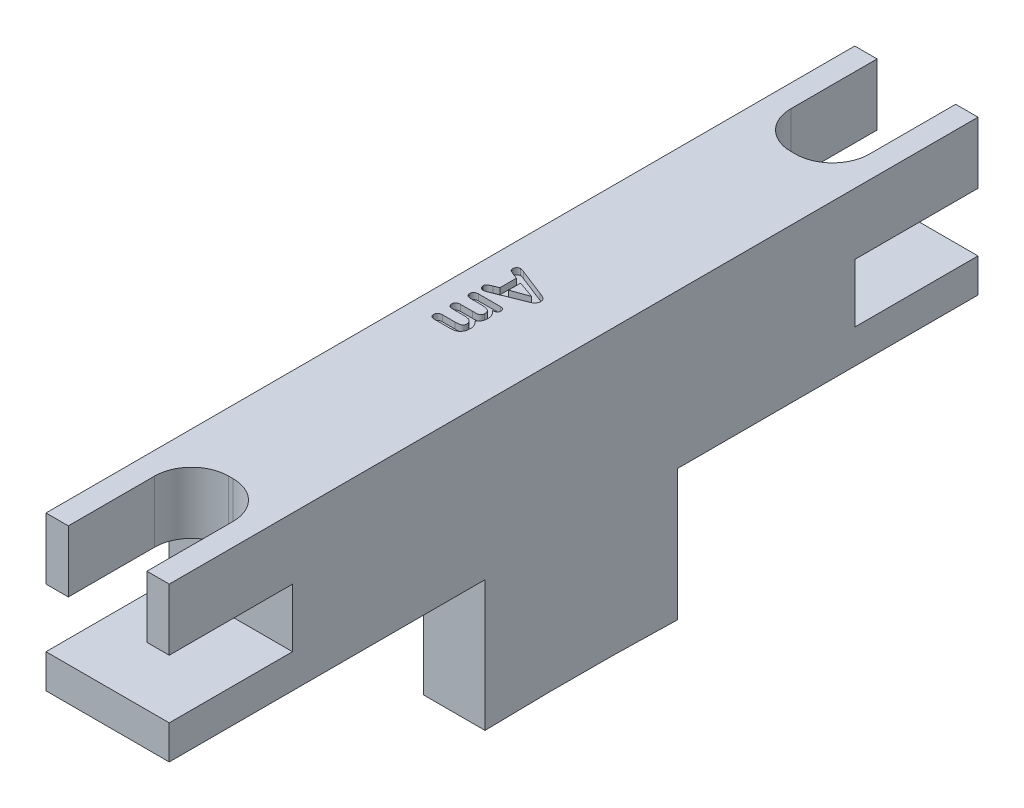
from build123d import *

# Parameters (mm, degrees)
SKETCH2_W            = 10.16
SKETCH2_H            = 66.675
BOSS_EXTRUDE1_DEPTH  = 12.7
SKETCH3_W            = 5.08
SKETCH3_H            = 6.35
SKETCH3_H_2          = 1.905
SKETCH3_H_3          = 1.27
BOSS_EXTRUDE2_DEPTH  = 12.7
CUT_EXTRUDE1_DEPTH   = 10.16
FILLET2_R            = 3.048
FILLET2_OF_MIRROR1_R = 3.048
CUT_EXTRUDE4_DEPTH   = 69.0635881
CUT_EXTRUDE5_DEPTH   = 0.508


with BuildPart() as part:
    # Sketch2 → Boss-Extrude1 (new body)
    with BuildSketch(Plane(origin=(0, 0, 0), x_dir=(1, 0, 0), z_dir=(0, 1, 0))):
        with Locations((5.08, 33.3375)):
            Rectangle(SKETCH2_W, SKETCH2_H)
    extrude(amount=BOSS_EXTRUDE1_DEPTH)

    # Sketch3 → Boss-Extrude2 (add)
    with BuildSketch(Plane.XZ):
        with Locations((7.62, -37.465)):
            Rectangle(SKETCH3_W, SKETCH3_H)
        with Locations((7.62, -33.3375)):
            Rectangle(SKETCH3_W, SKETCH3_H_2)
        with Locations((7.62, -29.21)):
            Rectangle(SKETCH3_W, SKETCH3_H)
        with Locations((7.62, -41.275)):
            Rectangle(SKETCH3_W, SKETCH3_H_3)
    extrude(amount=BOSS_EXTRUDE2_DEPTH)

    # Sketch4 → Cut-Extrude1 (cut)
    with BuildSketch(Plane.XY):
        Polygon((0, 7.62), (1.8415, 7.62), (1.8415, 12.7), (8.3185, 12.7), (8.3185, 7.62), (10.16, 7.62), (10.16, 2.794), (0, 2.794), align=None)
    cut_extrude1 = extrude(amount=-CUT_EXTRUDE1_DEPTH, mode=Mode.SUBTRACT)

    # Fillet2
    fillet2_edges = [part.edges().sort_by_distance(p)[0] for p in [
        (1.8415, 10.16, -10.16),
        (8.3185, 10.16, -10.16),
    ]]
    fillet(fillet2_edges, radius=FILLET2_R)

    # Mirror1: Cut-Extrude1 across plane
    add(cut_extrude1.mirror(Plane.XY.offset(-33.3375)), mode=Mode.SUBTRACT)

    # Fillet2 of Mirror1
    fillet2_of_mirror1_edges = [part.edges().sort_by_distance(p)[0] for p in [
        (1.8415, 10.16, -56.515),
        (8.3185, 10.16, -56.515),
    ]]
    fillet(fillet2_of_mirror1_edges, radius=FILLET2_OF_MIRROR1_R)

    # Sketch5 → Cut-Extrude4 (cut, through all)
    with BuildSketch(Plane.ZY.offset(-5.08)):
        with BuildLine():
            Line((-66.675, -12.7), (0, -12.7))
            ThreePointArc((0, -12.7), (-33.3375, -10.668), (-66.675, -12.7))
        make_face()
    extrude(amount=-CUT_EXTRUDE4_DEPTH, mode=Mode.SUBTRACT)

    # Sketch6 → Cut-Extrude5 (cut)
    # profile 1 of 2: a face of its own
    with BuildSketch(Plane(origin=(0, 12.7, 0), x_dir=(1, 0, 0), z_dir=(0, 1, 0))):
        with BuildLine():
            Line((3.024117187, 31.325), (2.192183594, 31.325))
            add(Edge.make_bspline(
                [(2.192183594, 31.325), (2.161338143, 31.325878008), (2.102981292, 31.327539122), (2.021373075, 31.344309551), (1.951866233, 31.373035235), (1.89508713, 31.413356319), (1.851267035, 31.46353237), (1.820049132, 31.521488509), (1.800862639, 31.586765491), (1.798813173, 31.632709318), (1.79775, 31.656542969)],
                knots=[0, 0, 0, 0, 1.266358617, 2.395837985, 3.40284976, 4.335732349, 5.231599188, 6.115692377, 7.022503512, 8, 8, 8, 8], degree=3))
            add(Edge.make_bspline(
                [(1.79775, 31.656542969), (1.798843764, 31.679686433), (1.800961405, 31.724494561), (1.81986295, 31.788120989), (1.851709039, 31.844363979), (1.895295371, 31.893564924), (1.951696335, 31.934063962), (2.02156354, 31.961716326), (2.10295026, 31.978783323), (2.161327413, 31.980397043), (2.192183594, 31.98125)],
                knots=[0, 0, 0, 0, 0.959247536, 1.857201947, 2.725516035, 3.623470446, 4.565917911, 5.579597411, 6.720657367, 8, 8, 8, 8], degree=3))
            Line((2.192183594, 31.98125), (3.189546875, 31.98125))
            add(Edge.make_bspline(
                [(3.189546875, 31.98125), (3.226692841, 31.981223581), (3.296674033, 31.981173808), (3.394897567, 31.984906505), (3.479936742, 31.989459486), (3.553156116, 31.995540119), (3.617305611, 32.006964235), (3.674493623, 32.025290013), (3.725720355, 32.050814077), (3.771240201, 32.083049666), (3.809351895, 32.124445714), (3.835651207, 32.17742662), (3.851232332, 32.240133271), (3.853039715, 32.285350526), (3.854, 32.309375)],
                knots=[0, 0, 0, 0, 1.575327959, 2.967841215, 4.168135644, 5.187490071, 6.082165716, 6.925686306, 7.72526632, 8.500469833, 9.28059761, 10.084546151, 10.982296201, 12, 12, 12, 12], degree=3))
            add(Edge.make_bspline(
                [(3.854, 32.309375), (3.853337257, 32.334015012), (3.852067681, 32.381216385), (3.842681588, 32.448719982), (3.826351273, 32.509691135), (3.803025404, 32.564352632), (3.773055951, 32.612570717), (3.735927836, 32.653850858), (3.692336163, 32.688254591), (3.642242947, 32.716313631), (3.58623843, 32.739290145), (3.524705548, 32.759003945), (3.457448176, 32.77513591), (3.384667297, 32.788774807), (3.306216997, 32.79976157), (3.221778995, 32.806891792), (3.131731589, 32.811976909), (3.06969796, 32.812322325), (3.037789062, 32.8125)],
                knots=[0, 0, 0, 0, 1.072726865, 2.054957592, 2.959985853, 3.813338004, 4.633692391, 5.420603725, 6.218633423, 7.040726042, 7.912341107, 8.850536995, 9.851629862, 10.921921998, 12.073946012, 13.299226168, 14.610774249, 16, 16, 16, 16], degree=3))
            Line((3.037789062, 32.8125), (2.192183594, 32.8125))
            add(Edge.make_bspline(
                [(2.192183594, 32.8125), (2.161552126, 32.813328724), (2.103843245, 32.814890019), (2.02316301, 32.832184428), (1.953847019, 32.859952119), (1.896609997, 32.899459611), (1.85188122, 32.948701923), (1.820958279, 33.006375095), (1.800694973, 33.070474309), (1.798751978, 33.115855379), (1.79775, 33.139257813)],
                knots=[0, 0, 0, 0, 1.266988192, 2.386972462, 3.398328206, 4.340886206, 5.243074081, 6.125898592, 7.033549998, 8, 8, 8, 8], degree=3))
            add(Edge.make_bspline(
                [(1.79775, 33.139257813), (1.798869895, 33.162393548), (1.80104872, 33.207405546), (1.819874651, 33.271833894), (1.852279366, 33.32877973), (1.895950618, 33.379235864), (1.952923361, 33.419991156), (2.022429987, 33.448325157), (2.103070777, 33.46656772), (2.160854711, 33.467993727), (2.1915, 33.46875)],
                knots=[0, 0, 0, 0, 0.955872848, 1.859709514, 2.746023205, 3.64789137, 4.600178314, 5.613935963, 6.734568273, 8, 8, 8, 8], degree=3))
            Line((2.1915, 33.46875), (3.980464844, 33.46875))
            add(Edge.make_bspline(
                [(3.980464844, 33.46875), (4.008101113, 33.467683688), (4.060409743, 33.465665422), (4.133992186, 33.451195351), (4.197150319, 33.425017781), (4.249201116, 33.388319021), (4.290405501, 33.34328902), (4.319733645, 33.290656438), (4.337397212, 33.231061927), (4.339134632, 33.189056842), (4.340035156, 33.167285156)],
                knots=[0, 0, 0, 0, 1.248966492, 2.363985007, 3.370183095, 4.316060979, 5.220194925, 6.105537004, 7.018079506, 8, 8, 8, 8], degree=3))
            add(Edge.make_bspline(
                [(4.340035156, 33.167285156), (4.339007203, 33.146221694), (4.337020526, 33.105513343), (4.320883377, 33.046874237), (4.292862515, 32.994350507), (4.255213555, 32.947781037), (4.208366036, 32.908504088), (4.151723336, 32.881317106), (4.087389416, 32.864402381), (4.041873684, 32.862640476), (4.0180625, 32.86171875)],
                knots=[0, 0, 0, 0, 1.012533589, 1.956875484, 2.898540199, 3.857472998, 4.823338609, 5.81384557, 6.856331155, 8, 8, 8, 8], degree=3))
            Line((4.0180625, 32.86171875), (3.958589844, 32.86171875))
            add(Edge.make_bspline(
                [(3.958589844, 32.86171875), (3.989495812, 32.83453811), (4.049384416, 32.781868327), (4.127097834, 32.694631303), (4.192658891, 32.60514066), (4.245248165, 32.511662835), (4.286098435, 32.414457494), (4.314838778, 32.312319166), (4.332421459, 32.204941824), (4.334295126, 32.131480813), (4.33525, 32.094042969)],
                knots=[0, 0, 0, 0, 1.114634638, 2.159903633, 3.159301083, 4.116094819, 5.060065846, 6.010198919, 6.985940124, 8, 8, 8, 8], degree=3))
            add(Edge.make_bspline(
                [(4.33525, 32.094042969), (4.334015287, 32.055701909), (4.331621087, 31.98135579), (4.314678178, 31.873746537), (4.285147187, 31.774479877), (4.244165042, 31.683337302), (4.190410827, 31.60061054), (4.125083819, 31.5258336), (4.047472005, 31.458456315), (3.988748079, 31.421318549), (3.958589844, 31.402246094)],
                knots=[0, 0, 0, 0, 1.110106727, 2.152578117, 3.144193379, 4.100926543, 5.036166651, 5.990211141, 6.967853688, 8, 8, 8, 8], degree=3))
            add(Edge.make_bspline(
                [(3.958589844, 31.402246094), (3.98885654, 31.37535606), (4.047694923, 31.3230819), (4.126823395, 31.239126771), (4.190768194, 31.150086851), (4.244734685, 31.059341017), (4.285394996, 30.963877585), (4.313953875, 30.863748841), (4.33261384, 30.758768079), (4.33436203, 30.686831969), (4.33525, 30.650292969)],
                knots=[0, 0, 0, 0, 1.115367949, 2.168272612, 3.170386143, 4.129817974, 5.072087581, 6.019862948, 6.994215459, 8, 8, 8, 8], degree=3))
            add(Edge.make_bspline(
                [(4.33525, 30.650292969), (4.334213999, 30.608284885), (4.332203535, 30.526764016), (4.312525513, 30.409054529), (4.281307986, 30.300094622), (4.237713481, 30.200532614), (4.182074936, 30.111495752), (4.115195482, 30.034052363), (4.037027956, 29.968311192), (3.977660387, 29.935455139), (3.947652344, 29.918847656)],
                knots=[0, 0, 0, 0, 1.152941859, 2.237398496, 3.267298389, 4.259246934, 5.212555278, 6.139849645, 7.059764894, 8, 8, 8, 8], degree=3))
            add(Edge.make_bspline(
                [(3.947652344, 29.918847656), (3.932736353, 29.912141531), (3.901238786, 29.897980444), (3.849139076, 29.882573767), (3.791635493, 29.867618221), (3.7277152, 29.857367554), (3.657957828, 29.848506294), (3.582060064, 29.841394364), (3.499921642, 29.838475781), (3.4431611, 29.837832926), (3.413765625, 29.8375)],
                knots=[0, 0, 0, 0, 0.72077696, 1.522039022, 2.392527629, 3.341243788, 4.375000762, 5.495464012, 6.702936508, 8, 8, 8, 8], degree=3))
            Line((3.413765625, 29.8375), (2.192183594, 29.8375))
            add(Edge.make_bspline(
                [(2.192183594, 29.8375), (2.161328116, 29.8383537), (2.102952293, 29.839968826), (2.02155675, 29.857026498), (1.951718071, 29.884709007), (1.895081234, 29.925207726), (1.85148889, 29.975234583), (1.819873643, 30.032754227), (1.800960357, 30.097694411), (1.798843213, 30.143394435), (1.79775, 30.166992188)],
                knots=[0, 0, 0, 0, 1.269718527, 2.402194636, 3.408248534, 4.343606252, 5.24185001, 6.120046476, 7.029263568, 8, 8, 8, 8], degree=3))
            add(Edge.make_bspline(
                [(1.79775, 30.166992188), (1.798776259, 30.189934649), (1.800775689, 30.234632762), (1.820915053, 30.297886002), (1.852254441, 30.355022293), (1.896715703, 30.404680611), (1.953557294, 30.445671946), (2.023040279, 30.474185443), (2.103854083, 30.491318421), (2.161555884, 30.492906865), (2.192183594, 30.49375)],
                knots=[0, 0, 0, 0, 0.949369564, 1.849628418, 2.725779374, 3.636651653, 4.591842168, 5.608690816, 6.730709907, 8, 8, 8, 8], degree=3))
            Line((2.192183594, 30.49375), (3.244234375, 30.49375))
            add(Edge.make_bspline(
                [(3.244234375, 30.49375), (3.276135081, 30.494133556), (3.336757955, 30.494862452), (3.422741708, 30.497005184), (3.498650041, 30.502704877), (3.565491597, 30.509543597), (3.625594097, 30.521398663), (3.679542718, 30.541932418), (3.728469252, 30.570070462), (3.77285843, 30.60457685), (3.810018747, 30.648994752), (3.83639817, 30.704075264), (3.850934714, 30.768956201), (3.85293959, 30.81519305), (3.854, 30.839648438)],
                knots=[0, 0, 0, 0, 1.423190491, 2.704576462, 3.835774627, 4.817962044, 5.701113927, 6.560068514, 7.379565508, 8.211388338, 9.056030056, 9.937952697, 10.909351167, 12, 12, 12, 12], degree=3))
            add(Edge.make_bspline(
                [(3.854, 30.839648438), (3.853037563, 30.860456547), (3.851123496, 30.901839144), (3.83690351, 30.963007962), (3.81318351, 31.022174465), (3.781274935, 31.07920405), (3.741545683, 31.132309186), (3.695753134, 31.180738323), (3.642547077, 31.222159992), (3.603204127, 31.244147776), (3.583296875, 31.255273438)],
                knots=[0, 0, 0, 0, 0.958273261, 1.905787515, 2.876746121, 3.88737006, 4.907925992, 5.925290398, 6.950211731, 8, 8, 8, 8], degree=3))
            add(Edge.make_bspline(
                [(3.583296875, 31.255273438), (3.569034715, 31.261008941), (3.538295879, 31.27337051), (3.48714292, 31.28717165), (3.428342051, 31.298431913), (3.362288605, 31.308956666), (3.288308489, 31.315941498), (3.206946336, 31.321656693), (3.118008091, 31.323881555), (3.056245976, 31.324617276), (3.024117187, 31.325)],
                knots=[0, 0, 0, 0, 0.650550776, 1.402113892, 2.238582892, 3.185730303, 4.233290645, 5.384198073, 6.639254042, 8, 8, 8, 8], degree=3))
        make_face()
    # profile 2 of 2: a face of its own
    with BuildSketch(Plane(origin=(0, 12.7, 0), x_dir=(1, 0, 0), z_dir=(0, 1, 0))):
        with BuildLine():
            Line((2.220894531, 34.630175781), (2.629, 34.790136719))
            Line((2.629, 34.790136719), (2.629, 36.151171875))
            Line((2.629, 36.151171875), (2.212007812, 36.311132812))
            add(Edge.make_bspline(
                [(2.212007812, 36.311132812), (2.174494518, 36.325820978), (2.105738716, 36.35274201), (2.013524922, 36.394468396), (1.940856289, 36.432290336), (1.88441907, 36.467362499), (1.842808713, 36.508271263), (1.816150366, 36.559568119), (1.800449781, 36.620790431), (1.798690345, 36.664901212), (1.79775, 36.688476562)],
                knots=[0, 0, 0, 0, 1.589179946, 2.912709847, 3.990397165, 4.820646782, 5.526248733, 6.26234321, 7.071295771, 8, 8, 8, 8], degree=3))
            add(Edge.make_bspline(
                [(1.79775, 36.688476562), (1.798923711, 36.709350692), (1.80123832, 36.750515396), (1.820105038, 36.809983847), (1.849904793, 36.865474392), (1.890909477, 36.915335315), (1.938806824, 36.95769508), (1.991709989, 36.98945387), (2.048426015, 37.009062179), (2.087671152, 37.011349233), (2.107417969, 37.0125)],
                knots=[0, 0, 0, 0, 1.012851797, 1.997388367, 3.003373292, 4.058581268, 5.118255936, 6.09654221, 7.042244815, 8, 8, 8, 8], degree=3))
            add(Edge.make_bspline(
                [(2.107417969, 37.0125), (2.131013914, 37.011555345), (2.179537805, 37.00961271), (2.240155547, 36.992709958), (2.293374825, 36.975661052), (2.341051464, 36.958225338), (2.396411749, 36.938064341), (2.435361751, 36.922388839), (2.456050781, 36.9140625)],
                knots=[0, 0, 0, 0, 1.162954171, 2.391557502, 3.08930458, 3.926034863, 4.898374222, 6, 6, 6, 6], degree=3))
            Line((2.456050781, 36.9140625), (4.653804687, 36.057519531))
            add(Edge.make_bspline(
                [(4.653804687, 36.057519531), (4.670428771, 36.051113113), (4.705020453, 36.037782526), (4.759677882, 36.017334175), (4.818470369, 35.993962658), (4.880973219, 35.970121703), (4.943246191, 35.945277035), (5.001274142, 35.9177815), (5.053899907, 35.889999082), (5.101389954, 35.861144082), (5.143684296, 35.829310109), (5.182099697, 35.793741829), (5.214436623, 35.751946673), (5.244403384, 35.707060747), (5.268677671, 35.656645473), (5.285672776, 35.600421669), (5.29596969, 35.5385942), (5.29714235, 35.495419307), (5.29775, 35.473046875)],
                knots=[0, 0, 0, 0, 0.906379869, 1.886010981, 2.968854674, 4.124928175, 5.289572165, 6.378603586, 7.389892814, 8.31643566, 9.202117826, 10.079567999, 10.970318812, 11.883493671, 12.821997982, 13.804710887, 14.862441745, 16, 16, 16, 16], degree=3))
            add(Edge.make_bspline(
                [(5.29775, 35.473046875), (5.297143023, 35.450446171), (5.29597131, 35.406817548), (5.285657146, 35.344325061), (5.268718356, 35.287386785), (5.244407201, 35.236711098), (5.215490665, 35.191190553), (5.182270432, 35.150541152), (5.14540971, 35.113950972), (5.090096874, 35.072422303), (5.014937447, 35.028580779), (4.934808779, 34.990179852), (4.863869551, 34.962917705), (4.802755001, 34.938536673), (4.733151734, 34.912137701), (4.68388638, 34.893577043), (4.65790625, 34.883789062)],
                knots=[0, 0, 0, 0, 1.00520059, 1.940449142, 2.809766755, 3.639873923, 4.433178694, 5.204465738, 5.971742598, 6.738416121, 8.27578173, 9.83615209, 10.687299641, 11.65709467, 12.764466697, 14, 14, 14, 14], degree=3))
            Line((4.65790625, 34.883789062), (2.474507812, 34.008789062))
            add(Edge.make_bspline(
                [(2.474507812, 34.008789062), (2.454470664, 34.000780275), (2.415885996, 33.985358101), (2.360134993, 33.963706725), (2.308078369, 33.947042494), (2.260554299, 33.932321275), (2.217278478, 33.920653382), (2.178277438, 33.912380787), (2.143571652, 33.907024394), (2.12178988, 33.906498136), (2.111519531, 33.90625)],
                knots=[0, 0, 0, 0, 1.366342978, 2.631107437, 3.785388659, 4.825962469, 5.781334485, 6.621722106, 7.350126631, 8, 8, 8, 8], degree=3))
            add(Edge.make_bspline(
                [(2.111519531, 33.90625), (2.092226041, 33.907426445), (2.053433355, 33.909791878), (1.997209022, 33.929532937), (1.943526082, 33.960395105), (1.894055079, 34.002282304), (1.85103675, 34.052295628), (1.820604178, 34.109857625), (1.801023182, 34.171819825), (1.798854098, 34.215086145), (1.79775, 34.237109375)],
                knots=[0, 0, 0, 0, 0.918866393, 1.847529694, 2.812122199, 3.862154056, 4.927509125, 5.939679135, 6.951264583, 8, 8, 8, 8], degree=3))
            add(Edge.make_bspline(
                [(1.79775, 34.237109375), (1.798800528, 34.262129105), (1.800770672, 34.309050699), (1.822297511, 34.373936), (1.856022157, 34.427652709), (1.89301113, 34.46544648), (1.929613066, 34.491416915), (1.963260812, 34.511831411), (2.003015285, 34.532959548), (2.062650091, 34.560955232), (2.135860724, 34.593644584), (2.193980868, 34.618613458), (2.220894531, 34.630175781)],
                knots=[0, 0, 0, 0, 1.202442774, 2.255041588, 3.251816137, 4.238368336, 4.781120761, 5.412282472, 6.134737701, 6.950402798, 8.587824681, 10, 10, 10, 10], degree=3))
        make_face()
        Polygon((3.154, 35.9734375), (3.154, 34.97265625), (4.554, 35.477832031), align=None, mode=Mode.SUBTRACT)
    extrude(amount=-CUT_EXTRUDE5_DEPTH, mode=Mode.SUBTRACT)


solid = part.part
